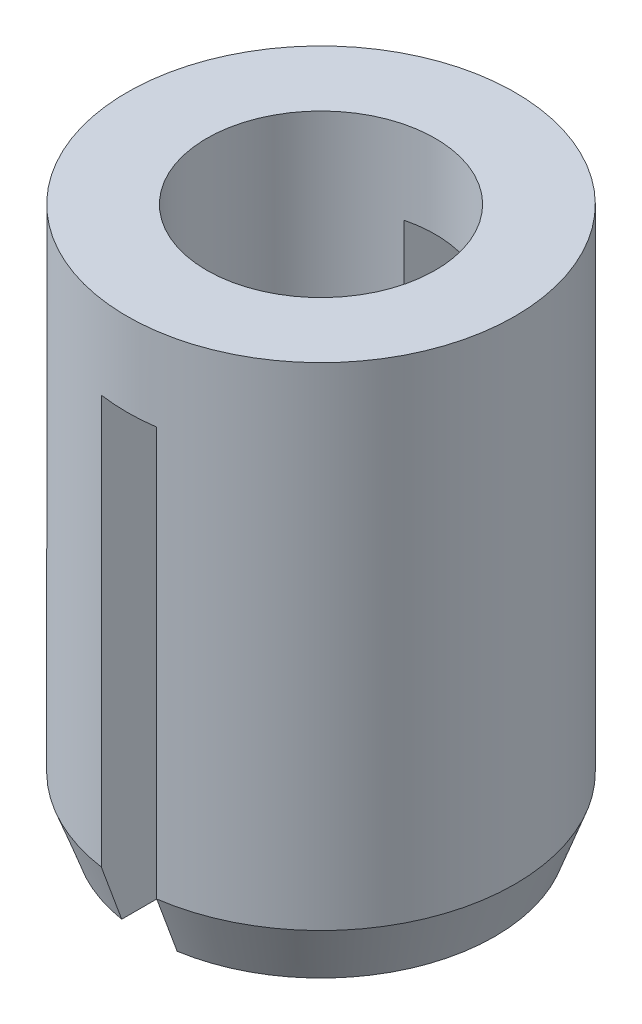
from build123d import *

# Parameters (mm, degrees)
M4_TAPPED_HOLE1_D       = 3.3
CUT_EXTRUDE1_DEPTH      = 9.836854644
CUT_EXTRUDE1_DEPTH_BACK = 9.836854644
SKETCH2_W               = 0.8
SKETCH2_H               = 6.7


with BuildPart() as part:
    # Sketch1 → Revolve1 (revolve)
    with BuildSketch(Plane.XY, mode=Mode.PRIVATE) as revolve1_sk:
        Polygon((0, -7.9), (0, 0), (-2.8, 0), (-2.8, -7.1), (-2.508823813, -7.9), align=None)
    revolve(revolve1_sk.sketch.rotate(Axis((0, -7.9, 0), (0, 1, 0)), 180), axis=Axis((0, -7.9, 0), (0, 1, 0)))

    # M4 Tapped Hole1 (through all)
    with Locations(Plane(origin=(0, 0, 0), x_dir=(1, 0, 0), z_dir=(0, 1, 0))):
        with Locations((0, 0)):
            Hole(M4_TAPPED_HOLE1_D / 2)

    # Sketch2 → Cut-Extrude1 (cut, two sides: drawn at the far end of the back side and taken through both)
    with BuildSketch(Plane.XY.offset(-CUT_EXTRUDE1_DEPTH_BACK)):
        with Locations((0, -4.55)):
            Rectangle(SKETCH2_W, SKETCH2_H)
    extrude(amount=CUT_EXTRUDE1_DEPTH + CUT_EXTRUDE1_DEPTH_BACK, mode=Mode.SUBTRACT)


solid = part.part
